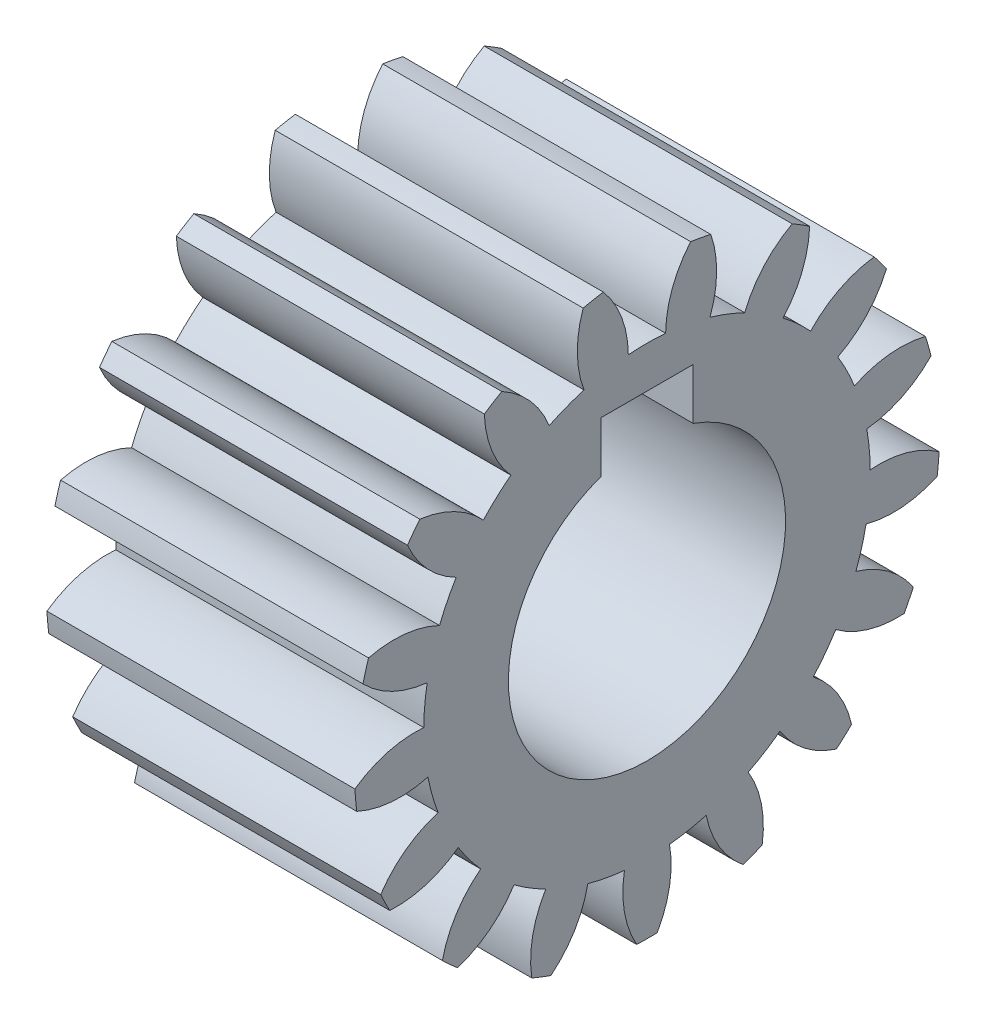
from build123d import *

# Parameters (mm, degrees)
BASPROSKE_W     = 10
BASPROSKE_H     = 9.5
TOOTHCUT_DEPTH  = 17.748134224
TEETHCUTS_COUNT = 17
TEETHCUTS_ANGLE = 338.823529412
BORSKE_R        = 4.5
BORE_DEPTH      = 50.0000508
KEYSKE_W        = 3
KEYSKE_H        = 5.9
KEYWAY_DEPTH    = 50.0000508


with BuildPart() as part:
    # BasProSke → Base-Revolve (revolve)
    with BuildSketch(Plane(origin=(0, 0, 0), x_dir=(1, 0, 0), z_dir=(0, 1, 0)), mode=Mode.PRIVATE) as base_revolve_sk:
        with Locations((5, 4.75)):
            Rectangle(BASPROSKE_W, BASPROSKE_H)
    revolve(base_revolve_sk.sketch.rotate(Axis((-10, 0, 0), (1, 0, 0)), 180), axis=Axis((-10, 0, 0), (1, 0, 0)))

    # TooCutSke → ToothCut (cut, through all)
    with BuildSketch(Plane(origin=(0, 0, 0), x_dir=(0, 0, -1), z_dir=(1, 0, 0))):
        with BuildLine():
            ThreePointArc((0.605407802, 7.223675131), (0, 7.249), (-0.605407802, 7.223675131))
            ThreePointArc((-0.605407802, 7.223675131), (-0.825997975, 8.393988613), (-1.436647238, 9.416437218))
            ThreePointArc((-1.436647238, 9.416437218), (0, 9.5254), (1.436647238, 9.416437218))
            ThreePointArc((1.436647238, 9.416437218), (0.825997975, 8.393988613), (0.605407802, 7.223675131))
        make_face()
    toothcut = extrude(amount=TOOTHCUT_DEPTH, mode=Mode.SUBTRACT)

    # TeethCuts: ToothCut ×17 about axis
    teethcuts_axis = Axis((-10, 0, 0), (1, 0, 0))
    for i in range(1, TEETHCUTS_COUNT):
        add(toothcut.rotate(teethcuts_axis, i * TEETHCUTS_ANGLE / (TEETHCUTS_COUNT - 1)), mode=Mode.SUBTRACT)

    # BorSke → Bore (cut, symmetric)
    with BuildSketch(Plane(origin=(0, 0, 0), x_dir=(0, 0, -1), z_dir=(1, 0, 0))):
        with Locations(Location((0, 0, 0), (0, 0, 180))):
            Circle(BORSKE_R)
    extrude(amount=BORE_DEPTH, both=True, mode=Mode.SUBTRACT)

    # KeySke → Keyway (cut, symmetric)
    with BuildSketch(Plane(origin=(0, 0, 0), x_dir=(0, 0, -1), z_dir=(1, 0, 0))):
        with Locations((0, 2.95)):
            Rectangle(KEYSKE_W, KEYSKE_H)
    extrude(amount=KEYWAY_DEPTH, both=True, mode=Mode.SUBTRACT)


solid = part.part
